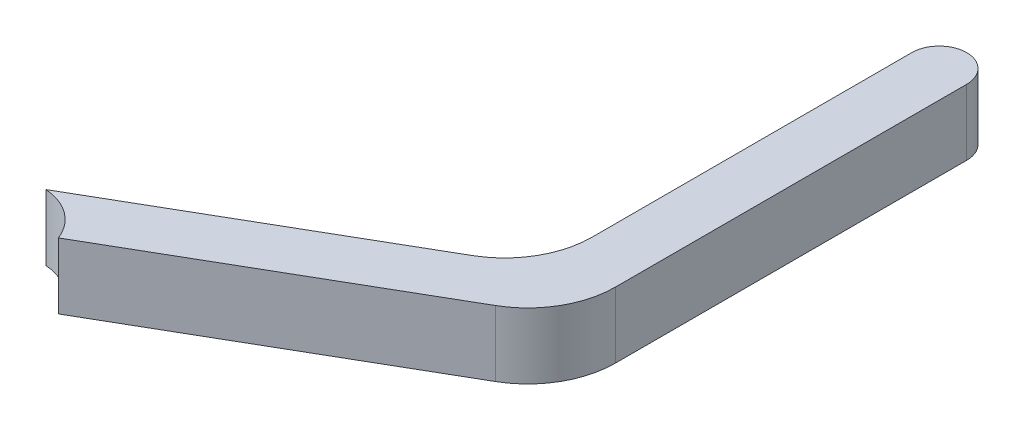
from build123d import *

# Parameters (mm, degrees)
BOSS_EXTRUDE1_DEPTH              = 19.05
CUT_EXTRUDE1_DEPTH               = 159.823046871
FILLET1_R                        = 25.4
F_1_8_0_125_DIAMETER_HOLE1_D     = 3.175
F_1_8_0_125_DIAMETER_HOLE1_DEPTH = 11.1252
F_1_8_0_125_DIAMETER_HOLE1_TIP   = 0.953866233


with BuildPart() as part:
    # Sketch1 → Boss-Extrude1 (new body)
    with BuildSketch(Plane(origin=(0, 0, 0), x_dir=(1, 0, 0), z_dir=(0, 1, 0))):
        with BuildLine():
            Line((7.9375, 111.6203), (7.9375, -4.582717762))
            Line((7.9375, -4.582717762), (-90.893507667, -61.642826643))
            ThreePointArc((-90.893507667, -61.642826643), (-101.73633431, -58.7375), (-98.831007667, -47.894673357))
            Line((-98.831007667, -47.894673357), (-7.9375, 4.582717762))
            Line((-7.9375, 4.582717762), (-7.9375, 111.6203))
            ThreePointArc((-7.9375, 111.6203), (0, 119.5578), (7.9375, 111.6203))
        make_face()
    extrude(amount=BOSS_EXTRUDE1_DEPTH)

    # Sketch2 → Cut-Extrude1 (cut, through all)
    with BuildSketch(Plane(origin=(0, 19.05, 0), x_dir=(1, 0, 0), z_dir=(0, 1, 0))):
        with BuildLine():
            Line((-90.893507667, -61.642826643), (-84.931832215, -58.200851716))
            ThreePointArc((-84.931832215, -58.200851716), (-90.389422779, -51.035617044), (-98.831007667, -47.894673357))
            ThreePointArc((-98.831007667, -47.894673357), (-101.73633431, -58.7375), (-90.893507667, -61.642826643))
        make_face()
    extrude(amount=-CUT_EXTRUDE1_DEPTH, mode=Mode.SUBTRACT)

    # Fillet1
    fillet1_edges = [part.edges().sort_by_distance(p)[0] for p in [
        (7.9375, 9.525, 4.582717762),
        (-7.9375, 9.525, -4.582717762),
    ]]
    fillet(fillet1_edges, radius=FILLET1_R)

    # 1/8 (0.125) Diameter Hole1
    with Locations(Plane(origin=(0, 0, 0), x_dir=(-1, 0, 0), z_dir=(0, -1, 0))):
        with Locations((0, 94.1578), (66.903536959, -38.626775073), (3.402954744, 1.964696837)):
            Hole(F_1_8_0_125_DIAMETER_HOLE1_D / 2, depth=F_1_8_0_125_DIAMETER_HOLE1_DEPTH)
            with Locations((0, 0, -(F_1_8_0_125_DIAMETER_HOLE1_DEPTH + F_1_8_0_125_DIAMETER_HOLE1_TIP / 2))):  # 118° drill point
                Cone(0, F_1_8_0_125_DIAMETER_HOLE1_D / 2, F_1_8_0_125_DIAMETER_HOLE1_TIP, mode=Mode.SUBTRACT)


solid = part.part
